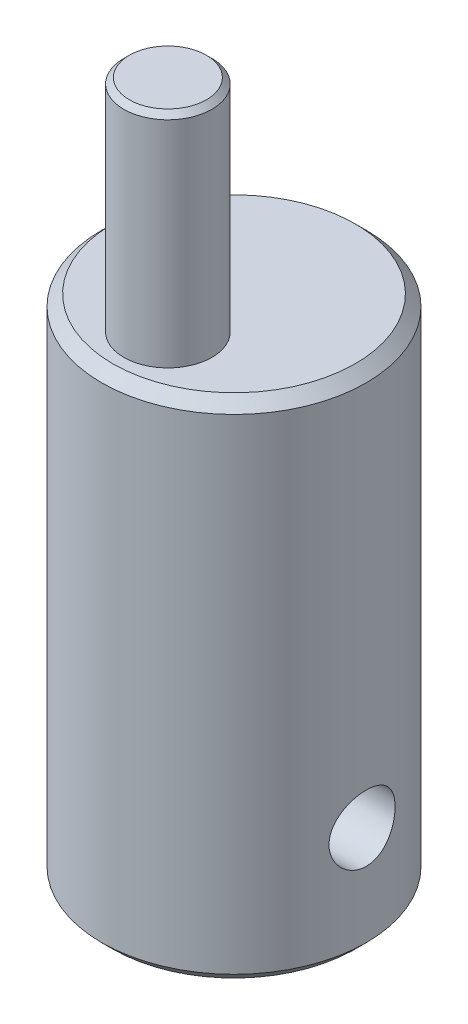
from build123d import *

# Parameters (mm, degrees)
SKETCH1_R           = 6
BOSS_EXTRUDE1_DEPTH = 23
SKETCH2_R           = 2
BOSS_EXTRUDE2_DEPTH = 10
SKETCH3_R           = 1.5
CUT_EXTRUDE1_DEPTH  = 14.5
CHAMFER1_SIZE       = 0.25
CHAMFER2_SIZE       = 0.5
CHAMFER3_SIZE       = 0.5


with BuildPart() as part:
    # Sketch1 → Boss-Extrude1 (new body)
    with BuildSketch(Plane(origin=(0, 0, 0), x_dir=(1, 0, 0), z_dir=(0, 1, 0))):
        with Locations(Location((0, 0, 0), (0, 0, 270))):
            Circle(SKETCH1_R)
    extrude(amount=BOSS_EXTRUDE1_DEPTH)

    # Sketch2 → Boss-Extrude2 (add)
    with BuildSketch(Plane(origin=(0, 23, 0), x_dir=(1, 0, 0), z_dir=(0, 1, 0))):
        with Locations(Location((0, -3, 0), (0, 0, 270))):
            Circle(SKETCH2_R)
    extrude(amount=BOSS_EXTRUDE2_DEPTH)

    # Sketch3 → Cut-Extrude1 (cut, symmetric)
    with BuildSketch(Plane(origin=(0, 0, 0), x_dir=(0, 0, -1), z_dir=(1, 0, 0))):
        with Locations((0, 5)):
            Circle(SKETCH3_R)
    extrude(amount=CUT_EXTRUDE1_DEPTH, both=True, mode=Mode.SUBTRACT)

    # Chamfer1
    chamfer1_edges = [part.edges().sort_by_distance(p)[0] for p in [
        (0, 33, 1),
    ]]
    chamfer(chamfer1_edges, length=CHAMFER1_SIZE)

    # Chamfer2
    chamfer2_edges = [part.edges().sort_by_distance(p)[0] for p in [
        (0, 23, -6),
    ]]
    chamfer(chamfer2_edges, length=CHAMFER2_SIZE)

    # Chamfer3
    chamfer3_edges = [part.edges().sort_by_distance(p)[0] for p in [
        (0, 0, -6),
    ]]
    chamfer(chamfer3_edges, length=CHAMFER3_SIZE)


solid = part.part
